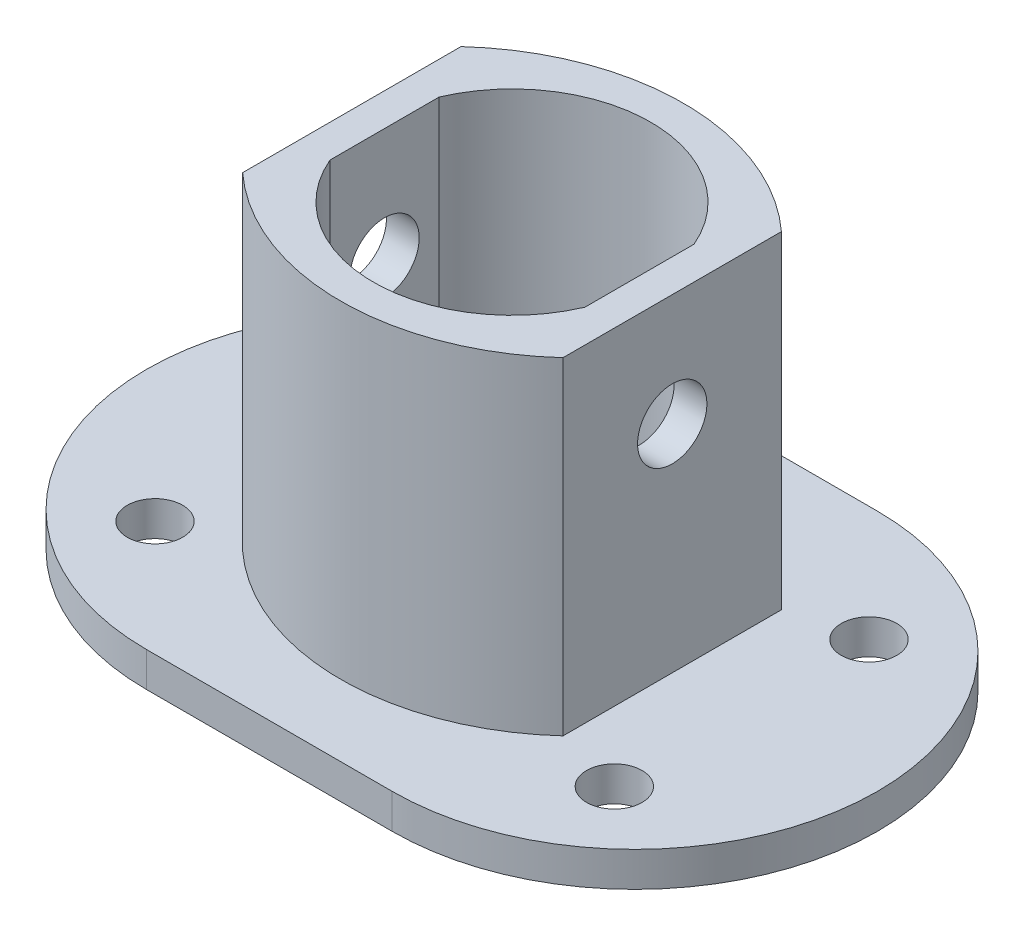
from build123d import *

# Parameters (mm, degrees)
BOSS_EXTRUDE1_DEPTH = 3.175
SKETCH2_R           = 2.54
CUT_EXTRUDE1_DEPTH  = 41.306412331
BOSS_EXTRUDE2_DEPTH = 30
SKETCH4_R           = 6.35
CUT_EXTRUDE2_DEPTH  = 51.145052099
SKETCH6_R           = 3.175
CUT_EXTRUDE3_DEPTH  = 66.447021029


with BuildPart() as part:
    # Sketch1 → Boss-Extrude1 (new body)
    with BuildSketch(Plane(origin=(0, 0, 0), x_dir=(1, 0, 0), z_dir=(0, 1, 0))):
        with BuildLine():
            Line((-11.25, 22.225), (11.25, 22.225))
            ThreePointArc((11.25, 22.225), (33.475, 0), (11.25, -22.225))
            Line((11.25, -22.225), (-11.25, -22.225))
            ThreePointArc((-11.25, -22.225), (-33.475, 0), (-11.25, 22.225))
        make_face()
    extrude(amount=BOSS_EXTRUDE1_DEPTH)

    # Sketch2 → Cut-Extrude1 (cut, through all)
    with BuildSketch(Plane(origin=(0, 3.175, 0), x_dir=(1, 0, 0), z_dir=(0, 1, 0))):
        with Locations(Location((-21.036441357, -11.663026646, 0), (0, 0, 270))):
            Circle(SKETCH2_R)
        with Locations(Location((-21.036441357, 11.663026646, 0), (0, 0, 270))):
            Circle(SKETCH2_R)
        with Locations(Location((21.036441357, -11.663026646, 0), (0, 0, 90))):
            Circle(SKETCH2_R)
        with Locations(Location((21.036441357, 11.663026646, 0), (0, 0, 90))):
            Circle(SKETCH2_R)
    extrude(amount=-CUT_EXTRUDE1_DEPTH, mode=Mode.SUBTRACT)

    # Sketch3 → Boss-Extrude2 (add)
    with BuildSketch(Plane(origin=(0, 3.175, 0), x_dir=(1, 0, 0), z_dir=(0, 1, 0))):
        with BuildLine():
            Line((-14.674330816, -10), (-14.674330816, 10))
            ThreePointArc((-14.674330816, 10), (0, 15.7), (14.674330816, 10))
            Line((14.674330816, 10), (14.674330816, -10))
            ThreePointArc((14.674330816, -10), (0, -15.7), (-14.674330816, -10))
        make_face()
        with BuildLine():
            Line((-11.674330816, 5), (-11.674330816, -5))
            ThreePointArc((-11.674330816, -5), (0, -12.7), (11.674330816, -5))
            Line((11.674330816, -5), (11.674330816, 5))
            ThreePointArc((11.674330816, 5), (0, 12.7), (-11.674330816, 5))
        make_face(mode=Mode.SUBTRACT)
    extrude(amount=BOSS_EXTRUDE2_DEPTH)

    # Sketch4 → Cut-Extrude2 (cut, through all)
    with BuildSketch(Plane(origin=(0, 3.175, 0), x_dir=(1, 0, 0), z_dir=(0, 1, 0))):
        with Locations(Location((0, 0, 0), (0, 0, 270))):
            Circle(SKETCH4_R)
    extrude(amount=-CUT_EXTRUDE2_DEPTH, mode=Mode.SUBTRACT)

    # Sketch6 → Cut-Extrude3 (cut, through all)
    with BuildSketch(Plane(origin=(-14.674330816, 2.247424982, 9.530938138), x_dir=(0, 0, 1), z_dir=(-1, 0, 0))):
        with Locations((-9.530938138, 20.677575018)):
            Circle(SKETCH6_R)
    extrude(amount=-CUT_EXTRUDE3_DEPTH, mode=Mode.SUBTRACT)


solid = part.part
